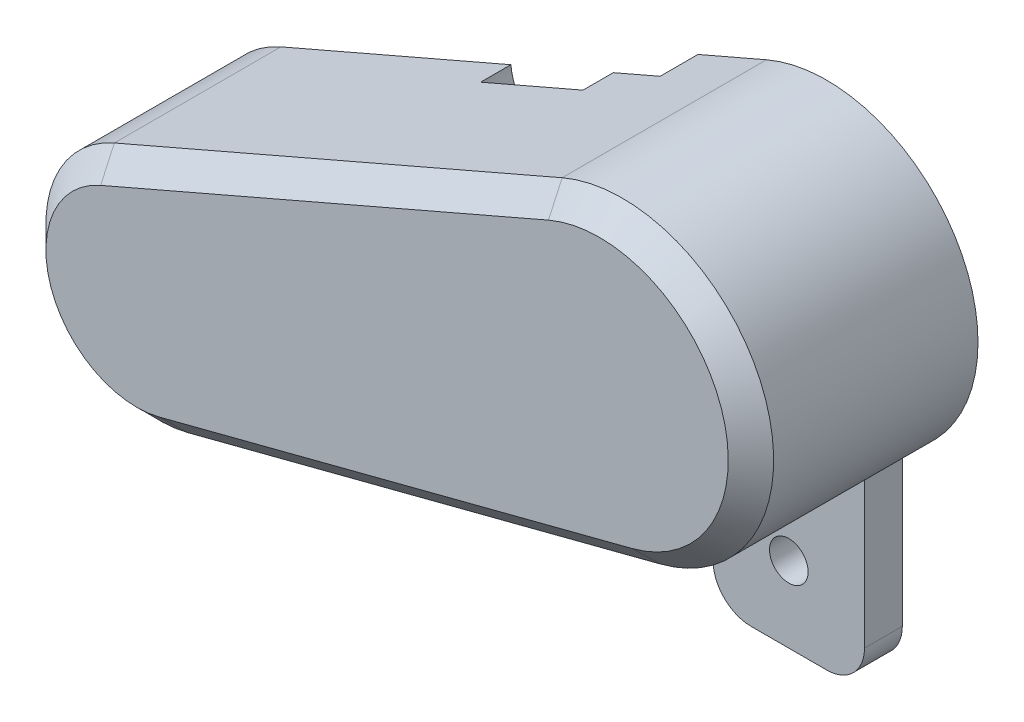
from build123d import *

# Parameters (mm, degrees)
BOSS_EXTRUDE1_DEPTH = 3
BOSS_EXTRUDE2_START = 27
BOSS_EXTRUDE2_DEPTH = 27
CHAMFER1_SIZE       = 3
CUT_EXTRUDE1_DEPTH  = 5
SKETCH4_3_R         = 7.75
CUT_EXTRUDE2_DEPTH  = 4
SKETCH7_R           = 2.55
BOSS_EXTRUDE5_DEPTH = 5


with BuildPart() as part:
    # Sketch2 → Boss-Extrude1 (new body)
    with BuildSketch(Plane.XY.offset(27)):
        with BuildLine():
            Line((-48.107762328, -39.75057759), (11.056310458, -14.145221365))
            ThreePointArc((11.056310458, -14.145221365), (37.914072471, -25.999413947), (24.018554683, -51.86011478))
            Line((24.018554683, -51.86011478), (-38.38607916, -68.036747651))
            ThreePointArc((-38.38607916, -68.036747651), (-56.335559182, -58.392101106), (-48.107762328, -39.75057759))
        make_face()
    extrude(amount=BOSS_EXTRUDE1_DEPTH)

    # Sketch3 → Boss-Extrude2 (add)
    with BuildSketch(Plane(origin=(0, 0, 27), x_dir=(-1, 0, 0), z_dir=(0, 0, -1)).offset(BOSS_EXTRUDE2_START)):
        with BuildLine():
            Line((48.107762328, -39.75057759), (-11.056310458, -14.145221365))
            ThreePointArc((-11.056310458, -14.145221365), (-37.914072471, -25.999413947), (-24.018554683, -51.86011478))
            Line((-24.018554683, -51.86011478), (38.38607916, -68.036747651))
            ThreePointArc((38.38607916, -68.036747651), (56.335559182, -58.392101106), (48.107762328, -39.75057759))
        make_face()
        with BuildLine():
            Line((46.916209863, -42.503794385), (-12.247862924, -16.89843816))
            ThreePointArc((-12.247862924, -16.89843816), (-35.076960635, -26.974501855), (-23.265770515, -48.956097563))
            Line((-23.265770515, -48.956097563), (39.138863328, -65.132730434))
            ThreePointArc((39.138863328, -65.132730434), (53.498447346, -57.417013198), (46.916209863, -42.503794385))
        make_face(mode=Mode.SUBTRACT)
    extrude(amount=-BOSS_EXTRUDE2_DEPTH)

    # Chamfer1
    chamfer1_edges = [part.edges().sort_by_distance(p)[0] for p in [
        (37.914072471, -25.999413947, 30),
        (-18.525725935, -26.947899478, 30),
        (-53.498447346, -57.417013198, 27),
        (-17.334173469, -29.701116273, 27),
        (35.076960635, -26.974501855, 27),
        (-7.936546407, -57.044413998, 27),
        (-56.335559182, -58.392101106, 30),
        (-7.183762238, -59.948431215, 30),
    ]]
    chamfer(chamfer1_edges, length=CHAMFER1_SIZE)

    # Sketch4 → Cut-Extrude1 (cut)
    with BuildSketch(Plane.XY.offset(5)):
        Polygon((-63.676072098, -10.5), (1.999993045, -10.5), (2.000000518, -39.366661566), (-18, -39.366661566), (-18, -71.666661566), (-63.676072098, -71.666661566), align=None)
    extrude(amount=-CUT_EXTRUDE1_DEPTH, mode=Mode.SUBTRACT)

    # Sketch4<3> → Cut-Extrude2 (cut)
    with BuildSketch(Plane.XY.offset(5)):
        with Locations((-10, -25.866661566)):
            Circle(SKETCH4_3_R)
    extrude(amount=CUT_EXTRUDE2_DEPTH, mode=Mode.SUBTRACT)

    # Sketch7 → Boss-Extrude5 (add)
    with BuildSketch(Plane(origin=(0, 0, 0), x_dir=(-1, 0, 0), z_dir=(0, 0, -1))):
        with BuildLine():
            Line((-8.999993562, -55.753251147), (-8.999993562, -70))
            ThreePointArc((-8.999993562, -70), (-10.464459657, -73.535533906), (-13.999993562, -75))
            Line((-13.999993562, -75), (-23.999993562, -75))
            ThreePointArc((-23.999993562, -75), (-27.535527468, -73.535533906), (-28.999993562, -70))
            Line((-28.999993562, -70), (-28.999993562, -49.820508076))
            ThreePointArc((-28.999993562, -49.820508076), (-26.578205318, -51.008665716), (-24.018554683, -51.86011478))
            Line((-24.018554683, -51.86011478), (-8.999993562, -55.753251147))
        make_face()
        with Locations((-18.999993562, -65)):
            Circle(SKETCH7_R, mode=Mode.SUBTRACT)
    extrude(amount=-BOSS_EXTRUDE5_DEPTH)


solid = part.part
